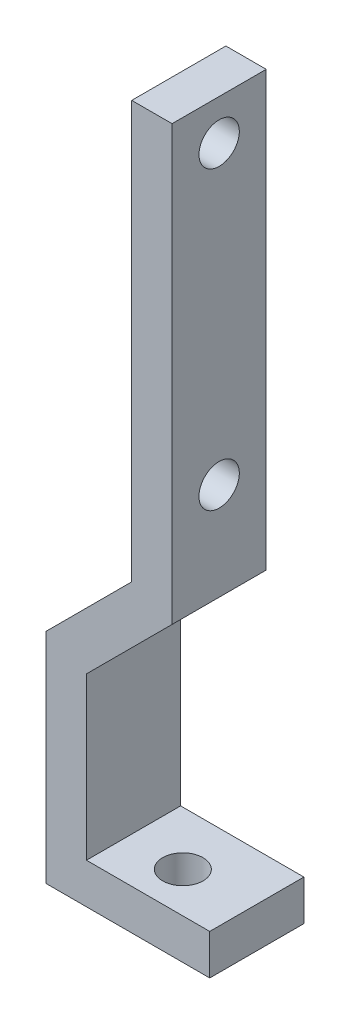
from build123d import *

# Parameters (mm, degrees)
SKETCH_1_W          = 1.5
SKETCH_1_H          = 3
SKETCH_1_W_2        = 3.5
EXTRUDE_1_DEPTH     = 7
SKETCH_2_R          = 1.5
CUT_EXTRUDE_2_DEPTH = 7
SKETCH_4_R          = 1.5
CUT_EXTRUDE_3_DEPTH = 7


with BuildPart() as part:
    # 草图1 → 凸台-拉伸1 (new body)
    with BuildSketch(Plane.XY):
        Polygon((-0.641080243, 21.986723194), (-3.641080243, 21.986723194), (-3.641080243, -9.013276806), (-10.005041274, -15.377237837), (-10.005041274, -31.619878524), (-4.341080243, -31.619878524), (-4.341080243, -28.619878524), (-7.005041274, -28.619878524), (-7.005041274, -16.619878524), (-0.641080243, -10.255917493), align=None)
        with Locations((-2.091080243, -30.119878524)):
            Rectangle(SKETCH_1_W, SKETCH_1_H)
        with Locations((-3.591080243, -30.119878524)):
            Rectangle(SKETCH_1_W, SKETCH_1_H)
        with Locations((0.408919757, -30.119878524)):
            Rectangle(SKETCH_1_W_2, SKETCH_1_H)
    extrude(amount=EXTRUDE_1_DEPTH)

    # 草图2 → 切除-拉伸2 (cut)
    with BuildSketch(Plane.ZY.offset(3.641080243)):
        with Locations(Location((3.5, 18.986723194, 0), (0, 0, 270))):
            Circle(SKETCH_2_R)
        with Locations(Location((3.5, -3.013276806, 0), (0, 0, 270))):
            Circle(SKETCH_2_R)
    extrude(amount=-CUT_EXTRUDE_2_DEPTH, mode=Mode.SUBTRACT)

    # 草图4 → 切除-拉伸3 (cut)
    with BuildSketch(Plane(origin=(0, -28.619878524, 0), x_dir=(1, 0, 0), z_dir=(0, 1, 0))):
        with Locations(Location((-2.841080243, -4, 0), (0, 0, 270))):
            Circle(SKETCH_4_R)
    extrude(amount=-CUT_EXTRUDE_3_DEPTH, mode=Mode.SUBTRACT)


solid = part.part
